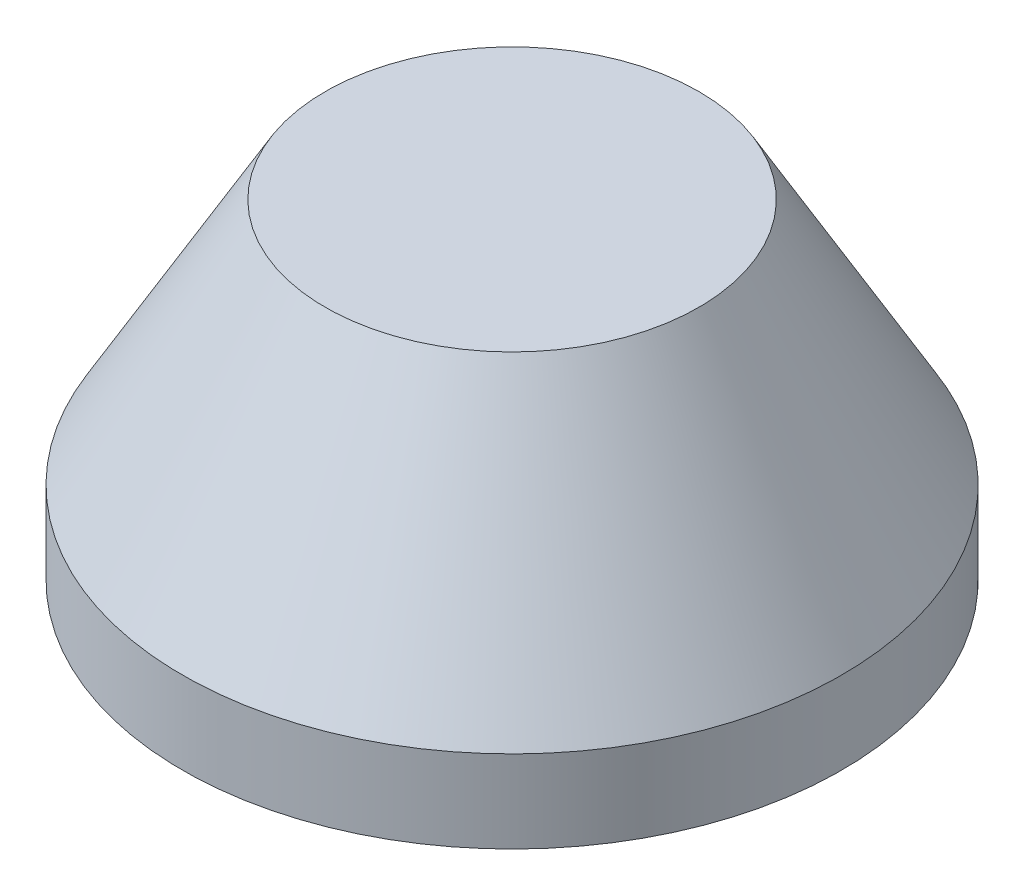
from build123d import *

# Parameters (mm, degrees)
F_5_8_0_75_DIAMETER_HOLE1_D     = 19.05
F_5_8_0_75_DIAMETER_HOLE1_DEPTH = 13.326802604
F_5_8_0_75_DIAMETER_HOLE1_TIP   = 5.723197396


with BuildPart() as part:
    # Sketch5 → Revolve2 (revolve)
    with BuildSketch(Plane.XY, mode=Mode.PRIVATE) as revolve2_sk:
        Polygon((0, 0), (-25.4, 0), (-25.4, 6.35), (-14.401477372, 25.4), (0, 25.4), align=None)
    revolve(revolve2_sk.sketch.rotate(Axis((0, 0, 0), (0, 1, 0)), 270), axis=Axis((0, 0, 0), (0, 1, 0)))

    # 5/8 (0.75) Diameter Hole1
    with Locations(Plane(origin=(0, 0, 0), x_dir=(-1, 0, 0), z_dir=(0, -1, 0))):
        with Locations((0, 0)):
            Hole(F_5_8_0_75_DIAMETER_HOLE1_D / 2, depth=F_5_8_0_75_DIAMETER_HOLE1_DEPTH)
            with Locations((0, 0, -(F_5_8_0_75_DIAMETER_HOLE1_DEPTH + F_5_8_0_75_DIAMETER_HOLE1_TIP / 2))):  # 118° drill point
                Cone(0, F_5_8_0_75_DIAMETER_HOLE1_D / 2, F_5_8_0_75_DIAMETER_HOLE1_TIP, mode=Mode.SUBTRACT)


solid = part.part
